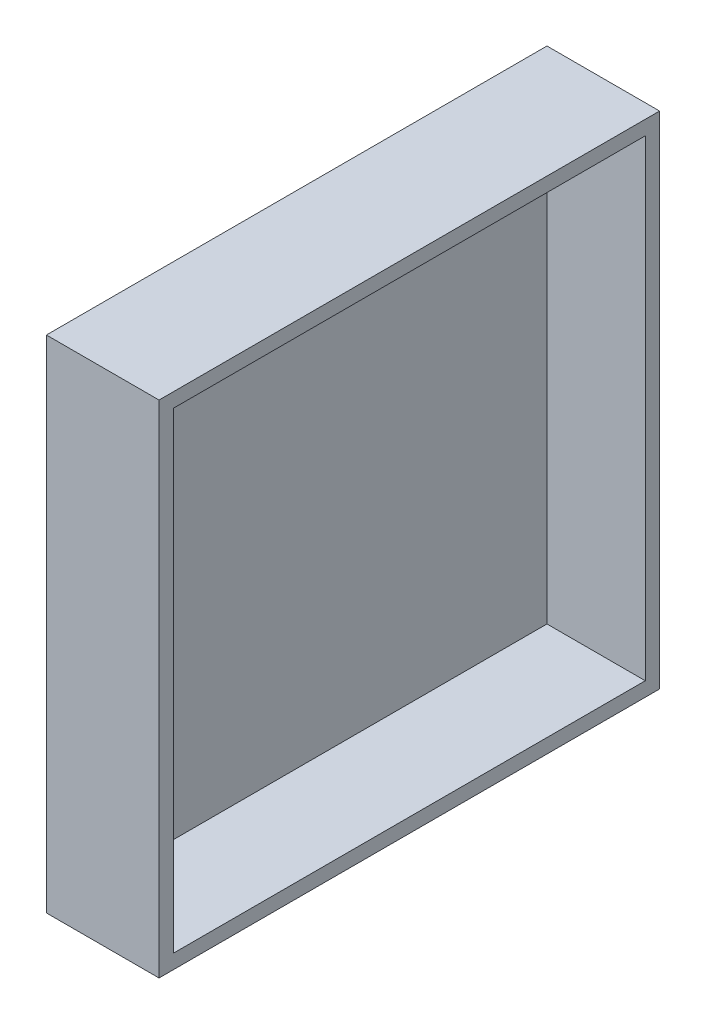
from build123d import *

# Parameters (mm, degrees)
SKETCH1_W           = 280
SKETCH1_H           = 280
BOSS_EXTRUDE1_DEPTH = 63
SKETCH2_W           = 264
SKETCH2_H           = 264
CUT_EXTRUDE1_DEPTH  = 55
SKETCH4_R           = 15
CUT_EXTRUDE2_DEPTH  = 55


with BuildPart() as part:
    # Sketch1 → Boss-Extrude1 (new body)
    with BuildSketch(Plane(origin=(0, 0, 0), x_dir=(0, 0, -1), z_dir=(1, 0, 0))):
        Rectangle(SKETCH1_W, SKETCH1_H)
    extrude(amount=BOSS_EXTRUDE1_DEPTH)

    # Sketch2 → Cut-Extrude1 (cut)
    with BuildSketch(Plane(origin=(63, 0, 0), x_dir=(0, 0, -1), z_dir=(1, 0, 0))):
        Rectangle(SKETCH2_W, SKETCH2_H)
    extrude(amount=-CUT_EXTRUDE1_DEPTH, mode=Mode.SUBTRACT)

    # Sketch4 → Cut-Extrude2 (cut)
    with BuildSketch(Plane(origin=(8, 0, 0), x_dir=(0, 0, -1), z_dir=(1, 0, 0))):
        with Locations((107, 107)):
            Circle(SKETCH4_R)
    extrude(amount=-CUT_EXTRUDE2_DEPTH, mode=Mode.SUBTRACT)


solid = part.part
